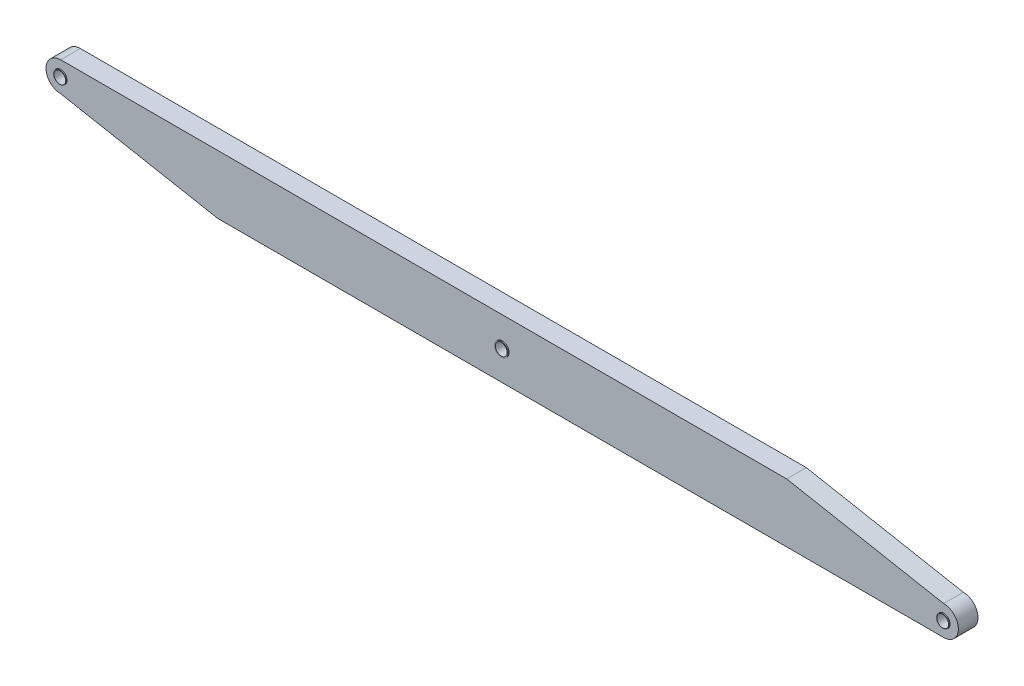
from build123d import *

# Parameters (mm, degrees)
EXTRUDE_1_DEPTH     = 100
SKETCH_2_R          = 30
CUT_EXTRUDE_1_DEPTH = 100
SKETCH_3_R          = 32.5
SKETCH_3_R_2        = 30
EXTRUDE_2_DEPTH     = 5
EXTRUDE_START       = 5
SKETCH_4_R          = 32.5
SKETCH_4_R_2        = 30
EXTRUDE_3_DEPTH     = 5
SKETCH_5_R          = 30
CUT_EXTRUDE_3_DEPTH = 552
SKETCH_6_R          = 35
SKETCH_6_R_2        = 30
EXTRUDE_4_DEPTH     = 5
SKETCH_7_R          = 35
SKETCH_7_R_2        = 30
EXTRUDE_5_DEPTH     = 5
SCALE_1_SCALE       = 0.345


with BuildPart() as part:
    # 草图1 → 凸台-拉伸1 (new body)
    with BuildSketch(Plane.XY):
        with BuildLine():
            Line((-60.1323511, -127.533248731), (739.8676489, -277.533248731))
            Line((739.8676489, -277.533248731), (4439.8676489, -277.533248731))
            ThreePointArc((4439.8676489, -277.533248731), (4514.8676489, -202.533248731), (4439.8676489, -127.533248731))
            Line((4439.8676489, -127.533248731), (3639.8676489, 22.466751269))
            Line((3639.8676489, 22.466751269), (-60.1323511, 22.466751269))
            ThreePointArc((-60.1323511, 22.466751269), (-135.1323511, -52.533248731), (-60.1323511, -127.533248731))
        make_face()
    extrude(amount=EXTRUDE_1_DEPTH)

    # 草图2 → 切除-拉伸1 (cut)
    with BuildSketch(Plane.XY.offset(100)):
        with Locations((-60.1323511, -52.533248731)):
            Circle(SKETCH_2_R)
        with Locations((4439.8676489, -202.533248731)):
            Circle(SKETCH_2_R)
    extrude(amount=-CUT_EXTRUDE_1_DEPTH, mode=Mode.SUBTRACT)

    # 草图3 → 凸台-拉伸2 (add)
    # profile 1 of 2: a face of its own
    with BuildSketch(Plane(origin=(0, 0, 0), x_dir=(-1, 0, 0), z_dir=(0, 0, -1))):
        with Locations(Location((-4439.8676489, -202.533248731, 0), (0, 0, 180))):
            Circle(SKETCH_3_R)
        with Locations(Location((-4439.8676489, -202.533248731, 0), (0, 0, 180))):
            Circle(SKETCH_3_R_2, mode=Mode.SUBTRACT)
    # profile 2 of 2: a face of its own
    with BuildSketch(Plane(origin=(0, 0, 0), x_dir=(-1, 0, 0), z_dir=(0, 0, -1))):
        with Locations(Location((60.1323511, -52.533248731, 0), (0, 0, 180))):
            Circle(SKETCH_3_R)
        with Locations(Location((60.1323511, -52.533248731, 0), (0, 0, 180))):
            Circle(SKETCH_3_R_2, mode=Mode.SUBTRACT)
    extrude(amount=EXTRUDE_2_DEPTH)

    # 草图4 → 凸台-拉伸3 (add)
    # profile 1 of 2: a face of its own
    with BuildSketch(Plane.XY.offset(100).offset(EXTRUDE_START)):
        with Locations((-60.1323511, -52.533248731)):
            Circle(SKETCH_4_R)
        with Locations((-60.1323511, -52.533248731)):
            Circle(SKETCH_4_R_2, mode=Mode.SUBTRACT)
    # profile 2 of 2: a face of its own
    with BuildSketch(Plane.XY.offset(100).offset(EXTRUDE_START)):
        with Locations((4439.8676489, -202.533248731)):
            Circle(SKETCH_4_R)
        with Locations((4439.8676489, -202.533248731)):
            Circle(SKETCH_4_R_2, mode=Mode.SUBTRACT)
    extrude(amount=-EXTRUDE_3_DEPTH)

    # 草图5 → 切除-拉伸3 (cut)
    with BuildSketch(Plane(origin=(0, 0, 0), x_dir=(-1, 0, 0), z_dir=(0, 0, -1))):
        with Locations((-2189.8676489, -127.533248731)):
            Circle(SKETCH_5_R)
    extrude(amount=-CUT_EXTRUDE_3_DEPTH, mode=Mode.SUBTRACT)

    # 草图6 → 凸台-拉伸4 (add)
    with BuildSketch(Plane.XY.offset(100)):
        with Locations((2189.8676489, -127.533248731)):
            Circle(SKETCH_6_R)
        with Locations(Location((2189.8676489, -127.533248731, 0), (0, 0, 180))):
            Circle(SKETCH_6_R_2, mode=Mode.SUBTRACT)
    extrude(amount=EXTRUDE_4_DEPTH)

    # 草图7 → 凸台-拉伸5 (add)
    with BuildSketch(Plane(origin=(0, 0, 0), x_dir=(-1, 0, 0), z_dir=(0, 0, -1)).offset(EXTRUDE_START)):
        with Locations(Location((-2189.8676489, -127.533248731, 0), (0, 0, 180))):
            Circle(SKETCH_7_R)
        with Locations((-2189.8676489, -127.533248731)):
            Circle(SKETCH_7_R_2, mode=Mode.SUBTRACT)
    extrude(amount=-EXTRUDE_5_DEPTH)


with BuildPart() as part_1:
    # 缩放比例1: scaled about (0, 0, 0)
    add(part.part.scale(SCALE_1_SCALE))


solid = part_1.part
